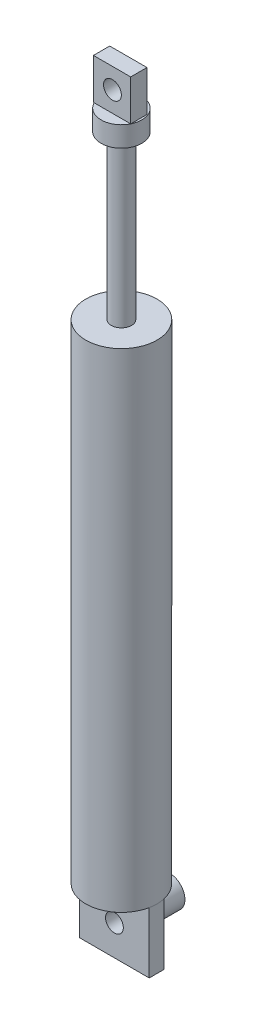
from build123d import *

# Parameters (mm, degrees)
SKETCH1_R           = 11.1125
BOSS_EXTRUDE1_DEPTH = 152.4
SKETCH2_R           = 3.175
BOSS_EXTRUDE2_DEPTH = 50.8
SKETCH3_W           = 21.757515496
SKETCH3_H           = 4.530998995
BOSS_EXTRUDE3_DEPTH = 19.05
SKETCH4_R           = 2.778125
CUT_EXTRUDE1_DEPTH  = 19.05
SKETCH5_R           = 4.7625
SKETCH5_R_2         = 2.778125
BOSS_EXTRUDE4_DEPTH = 12.7
SKETCH6_R           = 6.35
BOSS_EXTRUDE5_DEPTH = 6.35
SKETCH7_W           = 11.625186508
SKETCH7_H           = 5.08
BOSS_EXTRUDE6_DEPTH = 12.7
SKETCH8_R           = 2.778125
CUT_EXTRUDE2_DEPTH  = 12.7


with BuildPart() as part:
    # Sketch1 → Boss-Extrude1 (new body)
    with BuildSketch(Plane(origin=(0, 0, 0), x_dir=(1, 0, 0), z_dir=(0, 1, 0))):
        with Locations(Location((0, 0, 0), (0, 0, 90))):
            Circle(SKETCH1_R)
    extrude(amount=BOSS_EXTRUDE1_DEPTH)

    # Sketch2 → Boss-Extrude2 (add)
    with BuildSketch(Plane(origin=(0, 152.4, 0), x_dir=(1, 0, 0), z_dir=(0, 1, 0))):
        with Locations(Location((0, 0, 0), (0, 0, 270))):
            Circle(SKETCH2_R)
    extrude(amount=BOSS_EXTRUDE2_DEPTH)

    # Sketch3 → Boss-Extrude3 (add)
    with BuildSketch(Plane.XZ):
        with Locations((-0.018003691, -0.086452367)):
            Rectangle(SKETCH3_W, SKETCH3_H)
    extrude(amount=BOSS_EXTRUDE3_DEPTH)

    # Sketch4 → Cut-Extrude1 (cut)
    with BuildSketch(Plane.XY.offset(2.179047131)):
        with Locations((0, -9.525)):
            Circle(SKETCH4_R)
    extrude(amount=-CUT_EXTRUDE1_DEPTH, mode=Mode.SUBTRACT)

    # Sketch5 → Boss-Extrude4 (add)
    with BuildSketch(Plane(origin=(0, 0, -2.351951864), x_dir=(-1, 0, 0), z_dir=(0, 0, -1))):
        with Locations(Location((0, -9.525, 0), (0, 0, 180))):
            Circle(SKETCH5_R)
        with Locations(Location((0, -9.525, 0), (0, 0, 180))):
            Circle(SKETCH5_R_2, mode=Mode.SUBTRACT)
    extrude(amount=BOSS_EXTRUDE4_DEPTH)

    # Sketch6 → Boss-Extrude5 (add)
    with BuildSketch(Plane(origin=(0, 203.2, 0), x_dir=(1, 0, 0), z_dir=(0, 1, 0))):
        with Locations(Location((0, 0, 0), (0, 0, 270))):
            Circle(SKETCH6_R)
    extrude(amount=BOSS_EXTRUDE5_DEPTH)

    # Sketch7 → Boss-Extrude6 (add)
    with BuildSketch(Plane(origin=(0, 209.55, 0), x_dir=(1, 0, 0), z_dir=(0, 1, 0))):
        with Locations((-0.116507708, -0.266618865)):
            Rectangle(SKETCH7_W, SKETCH7_H)
    extrude(amount=BOSS_EXTRUDE6_DEPTH)

    # Sketch8 → Cut-Extrude2 (cut)
    with BuildSketch(Plane.XY.offset(2.806618865)):
        with Locations((0, 215.9)):
            Circle(SKETCH8_R)
    extrude(amount=-CUT_EXTRUDE2_DEPTH, mode=Mode.SUBTRACT)


solid = part.part
